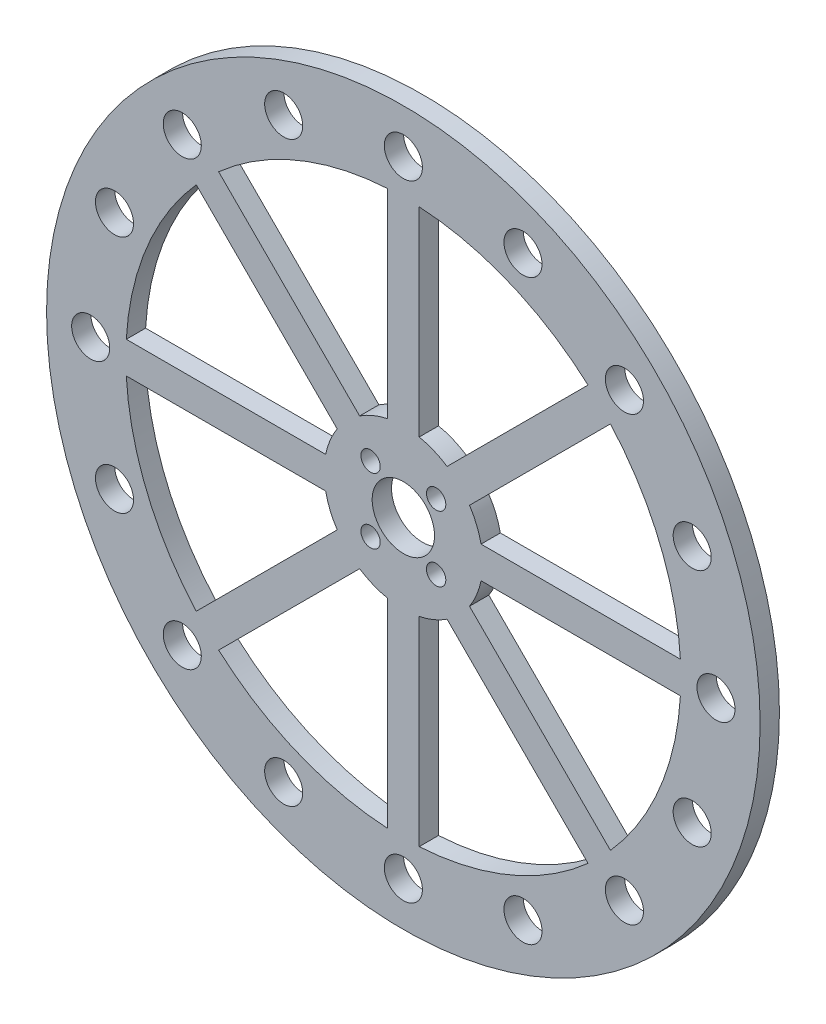
from build123d import *

# Parameters (mm, degrees)
MODEL_R             = 58.667489702
MODEL_R_2           = 1.591156764
MODEL_R_3           = 5.125
MODEL_R_4           = 3.130979628
BOSS_EXTRUDE1_DEPTH = 3.175


with BuildPart() as part:
    # Model → Boss-Extrude1 (new body)
    with BuildSketch(Plane.XY):
        Circle(MODEL_R)
        with Locations((5.389401941, 5.35857693)):
            Circle(MODEL_R_2, mode=Mode.SUBTRACT)
        Circle(MODEL_R_3, mode=Mode.SUBTRACT)
        with Locations((-5.389401941, 5.35857693)):
            Circle(MODEL_R_2, mode=Mode.SUBTRACT)
        with Locations((-5.389401941, -5.420226952)):
            Circle(MODEL_R_2, mode=Mode.SUBTRACT)
        with Locations((5.389401941, -5.420226952)):
            Circle(MODEL_R_2, mode=Mode.SUBTRACT)
        with Locations((-51.409488894, 0)):
            Circle(MODEL_R_4, mode=Mode.SUBTRACT)
        with Locations((-47.496174566, 19.673559666)):
            Circle(MODEL_R_4, mode=Mode.SUBTRACT)
        with Locations((-36.351998214, 36.351998214)):
            Circle(MODEL_R_4, mode=Mode.SUBTRACT)
        with Locations((-19.673559666, 47.496174566)):
            Circle(MODEL_R_4, mode=Mode.SUBTRACT)
        with Locations((0, 51.409488894)):
            Circle(MODEL_R_4, mode=Mode.SUBTRACT)
        with Locations((19.673559666, 47.496174566)):
            Circle(MODEL_R_4, mode=Mode.SUBTRACT)
        with Locations((36.351998214, 36.351998214)):
            Circle(MODEL_R_4, mode=Mode.SUBTRACT)
        with Locations((47.496174566, 19.673559666)):
            Circle(MODEL_R_4, mode=Mode.SUBTRACT)
        with Locations((51.409488894, 0)):
            Circle(MODEL_R_4, mode=Mode.SUBTRACT)
        with Locations((47.496174566, -19.673559666)):
            Circle(MODEL_R_4, mode=Mode.SUBTRACT)
        with Locations((36.351998214, -36.351998214)):
            Circle(MODEL_R_4, mode=Mode.SUBTRACT)
        with Locations((19.673559666, -47.496174566)):
            Circle(MODEL_R_4, mode=Mode.SUBTRACT)
        with Locations((0, -51.409488894)):
            Circle(MODEL_R_4, mode=Mode.SUBTRACT)
        with Locations((-19.673559666, -47.496174566)):
            Circle(MODEL_R_4, mode=Mode.SUBTRACT)
        with Locations((-36.351998214, -36.351998214)):
            Circle(MODEL_R_4, mode=Mode.SUBTRACT)
        with Locations((-47.496174566, -19.673559666)):
            Circle(MODEL_R_4, mode=Mode.SUBTRACT)
        with BuildLine():
            Line((-34.056493108, 30.369010459), (-10.87619225, 7.188709601))
            ThreePointArc((-10.87619225, 7.188709601), (-12.044820658, 4.989128073), (-12.773814601, 2.607443987))
            Line((-12.773814601, 2.607443987), (-45.555710454, 2.607443987))
            ThreePointArc((-45.555710454, 2.607443987), (-42.156872302, 17.461948255), (-34.056493108, 30.369010459))
        make_face(mode=Mode.SUBTRACT)
        with BuildLine():
            Line((-7.188709601, 10.87619225), (-30.369010459, 34.056493108))
            ThreePointArc((-30.369010459, 34.056493108), (-17.461948255, 42.156872302), (-2.607443987, 45.555710454))
            Line((-2.607443987, 45.555710454), (-2.607443987, 12.773814601))
            ThreePointArc((-2.607443987, 12.773814601), (-4.989128073, 12.044820658), (-7.188709601, 10.87619225))
        make_face(mode=Mode.SUBTRACT)
        with BuildLine():
            Line((2.607443987, 12.773814601), (2.607443987, 45.555710454))
            ThreePointArc((2.607443987, 45.555710454), (17.461948254, 42.156872302), (30.369010459, 34.056493108))
            Line((30.369010459, 34.056493108), (7.188709601, 10.87619225))
            ThreePointArc((7.188709601, 10.87619225), (4.989128073, 12.044820658), (2.607443987, 12.773814601))
        make_face(mode=Mode.SUBTRACT)
        with BuildLine():
            Line((10.87619225, 7.188709601), (34.056493108, 30.369010459))
            ThreePointArc((34.056493108, 30.369010459), (42.156872302, 17.461948255), (45.555710454, 2.607443987))
            Line((45.555710454, 2.607443987), (12.773814601, 2.607443987))
            ThreePointArc((12.773814601, 2.607443987), (12.044820658, 4.989128073), (10.87619225, 7.188709601))
        make_face(mode=Mode.SUBTRACT)
        with BuildLine():
            Line((12.773814601, -2.607443987), (45.555710454, -2.607443987))
            ThreePointArc((45.555710454, -2.607443987), (42.156872302, -17.461948254), (34.056493108, -30.369010459))
            Line((34.056493108, -30.369010459), (10.87619225, -7.188709601))
            ThreePointArc((10.87619225, -7.188709601), (12.044820658, -4.989128073), (12.773814601, -2.607443987))
        make_face(mode=Mode.SUBTRACT)
        with BuildLine():
            Line((7.188709601, -10.87619225), (30.369010459, -34.056493108))
            ThreePointArc((30.369010459, -34.056493108), (17.461948255, -42.156872302), (2.607443987, -45.555710454))
            Line((2.607443987, -45.555710454), (2.607443987, -12.773814601))
            ThreePointArc((2.607443987, -12.773814601), (4.989128073, -12.044820658), (7.188709601, -10.87619225))
        make_face(mode=Mode.SUBTRACT)
        with BuildLine():
            Line((-45.555710454, -2.607443987), (-12.773814601, -2.607443987))
            ThreePointArc((-12.773814601, -2.607443987), (-12.044820658, -4.989128073), (-10.87619225, -7.188709601))
            Line((-10.87619225, -7.188709601), (-34.056493108, -30.369010459))
            ThreePointArc((-34.056493108, -30.369010459), (-42.156872302, -17.461948254), (-45.555710454, -2.607443987))
        make_face(mode=Mode.SUBTRACT)
        with BuildLine():
            Line((-2.607443987, -12.773814601), (-2.607443987, -45.555710454))
            ThreePointArc((-2.607443987, -45.555710454), (-17.461948255, -42.156872302), (-30.369010459, -34.056493108))
            Line((-30.369010459, -34.056493108), (-7.188709601, -10.87619225))
            ThreePointArc((-7.188709601, -10.87619225), (-4.989128073, -12.044820658), (-2.607443987, -12.773814601))
        make_face(mode=Mode.SUBTRACT)
    extrude(amount=BOSS_EXTRUDE1_DEPTH)


solid = part.part
